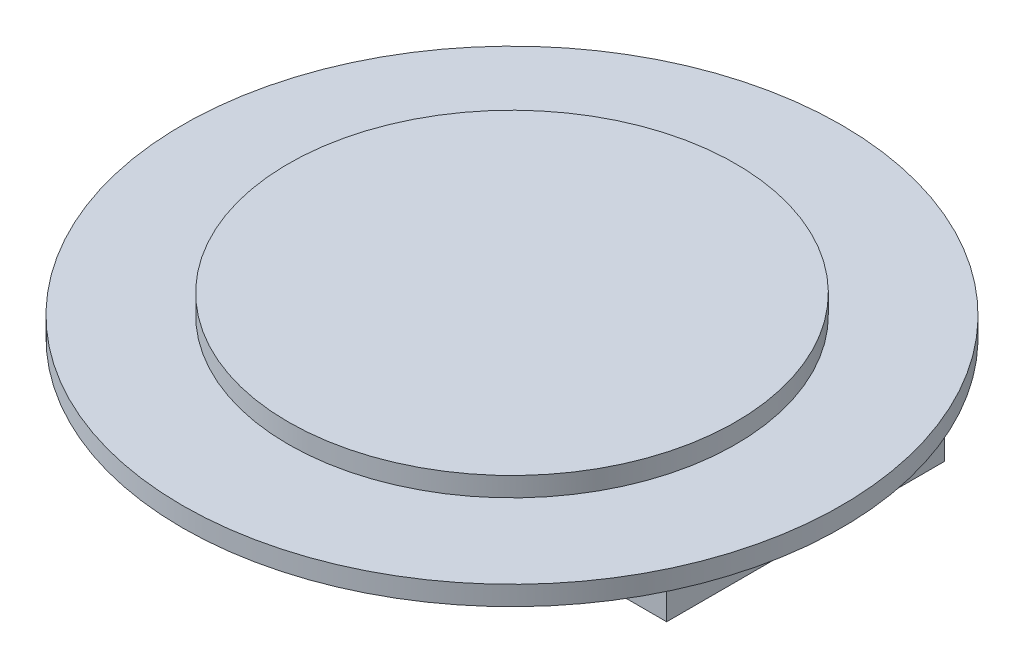
from build123d import *

# Parameters (mm, degrees)
SKETCH1_R           = 17
BOSS_EXTRUDE1_DEPTH = 1
SKETCH2_W           = 18.565645136
SKETCH2_H           = 14.338667356
BOSS_EXTRUDE2_DEPTH = 4
SKETCH3_R           = 11.539294854
BOSS_EXTRUDE3_DEPTH = 1


with BuildPart() as part:
    # Sketch1 → Boss-Extrude1 (new body)
    with BuildSketch(Plane(origin=(0, 0, 0), x_dir=(1, 0, 0), z_dir=(0, 1, 0))):
        with Locations(Location((0, 0, 0), (0, 0, 270))):
            Circle(SKETCH1_R)
    extrude(amount=BOSS_EXTRUDE1_DEPTH)

    # Sketch2 → Boss-Extrude2 (add)
    with BuildSketch(Plane.XZ):
        with Locations((3.402156218, -2.462998516)):
            Rectangle(SKETCH2_W, SKETCH2_H)
    extrude(amount=BOSS_EXTRUDE2_DEPTH)

    # Sketch3 → Boss-Extrude3 (add)
    with BuildSketch(Plane(origin=(0, 1, 0), x_dir=(1, 0, 0), z_dir=(0, 1, 0))):
        with Locations(Location((0, 0, 0), (0, 0, 270))):
            Circle(SKETCH3_R)
    extrude(amount=BOSS_EXTRUDE3_DEPTH)


solid = part.part
